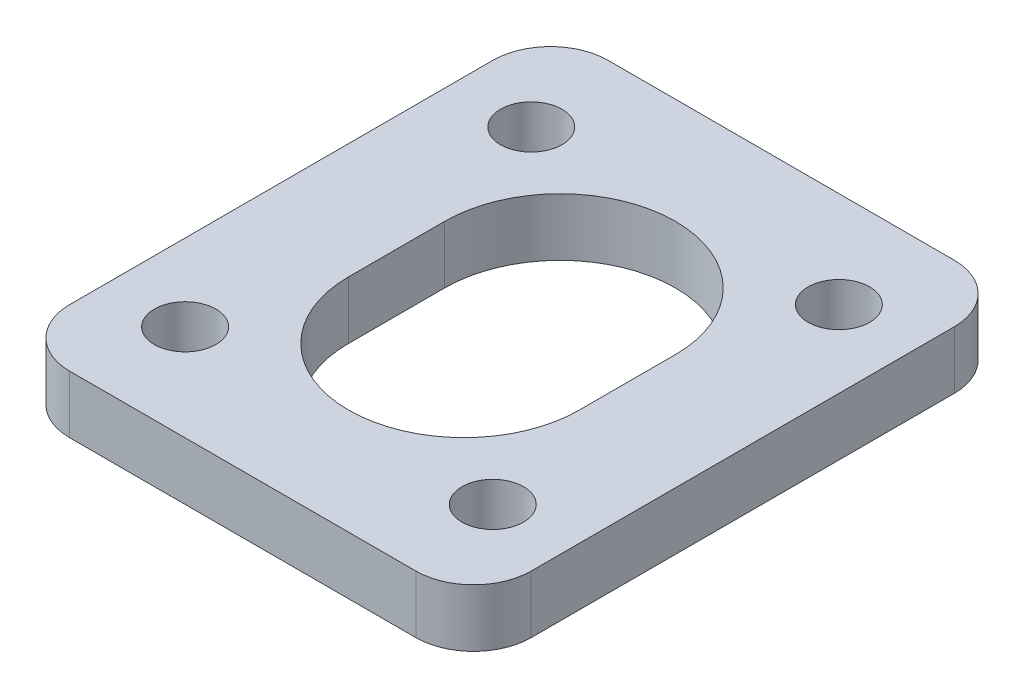
from build123d import *

# Parameters (mm, degrees)
SKETCH_1_W      = 24
SKETCH_1_H      = 28
SKETCH_1_R      = 1.6
EXTRUDE_1_DEPTH = 3
FILLET_1_R      = 3


with BuildPart() as part:
    # 草图1 → 凸台-拉伸1 (new body)
    with BuildSketch(Plane(origin=(0, 0, 0), x_dir=(1, 0, 0), z_dir=(0, 1, 0))):
        Rectangle(SKETCH_1_W, SKETCH_1_H)
        with Locations(Location((8, -9, 0), (0, 0, 270))):
            Circle(SKETCH_1_R, mode=Mode.SUBTRACT)
        with Locations(Location((-8, -9, 0), (0, 0, 270))):
            Circle(SKETCH_1_R, mode=Mode.SUBTRACT)
        with Locations(Location((-8, 9, 0), (0, 0, 270))):
            Circle(SKETCH_1_R, mode=Mode.SUBTRACT)
        with Locations(Location((8, 9, 0), (0, 0, 270))):
            Circle(SKETCH_1_R, mode=Mode.SUBTRACT)
        with BuildLine():
            Line((6, 2.5), (6, -2.5))
            ThreePointArc((6, -2.5), (0, -8.5), (-6, -2.5))
            Line((-6, -2.5), (-6, 2.5))
            ThreePointArc((-6, 2.5), (0, 8.5), (6, 2.5))
        make_face(mode=Mode.SUBTRACT)
    extrude(amount=EXTRUDE_1_DEPTH)

    # 圆角1
    fillet_1_edges = [part.edges().sort_by_distance(p)[0] for p in [
        (12, 1.5, 14),
        (-12, 1.5, 14),
        (-12, 1.5, -14),
        (12, 1.5, -14),
    ]]
    fillet(fillet_1_edges, radius=FILLET_1_R)


solid = part.part
